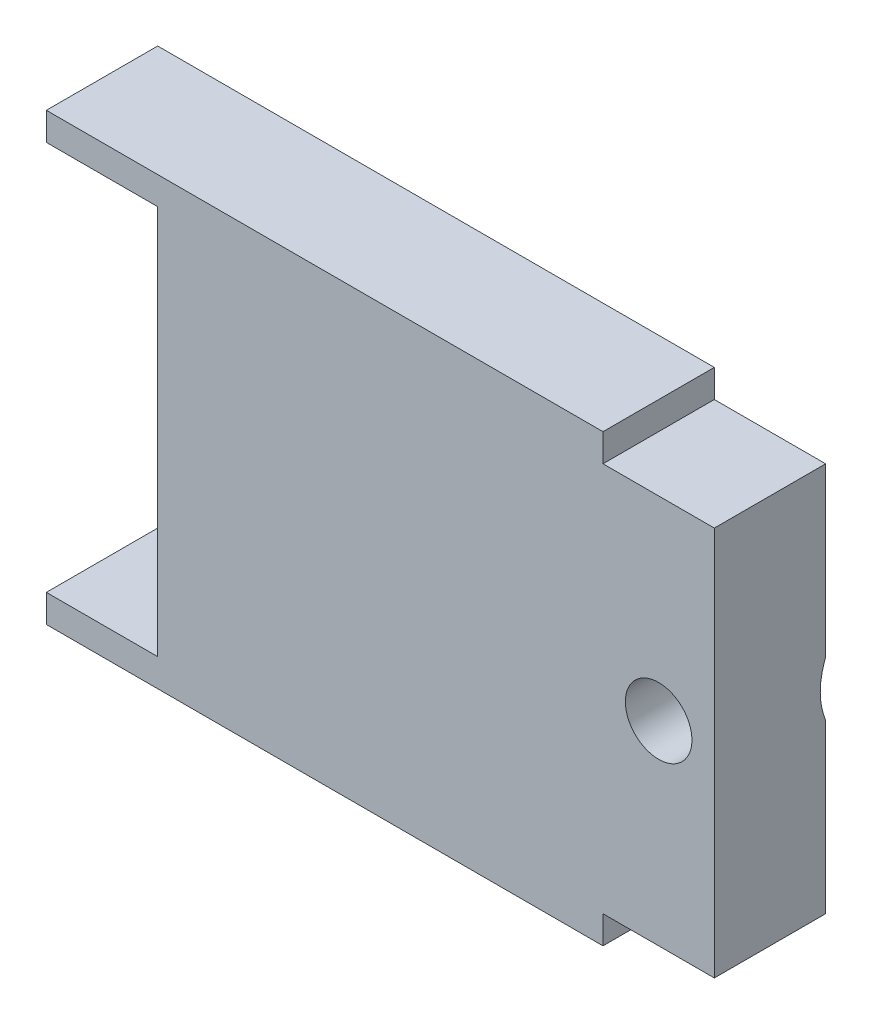
from build123d import *

# Parameters (mm, degrees)
BOSS_EXTRUDE1_DEPTH                               = 6.35
TAP_DRILL_FOR_6_32_TAP1_D                         = 2.7051
TAP_DRILL_FOR_6_32_TAP1_DEPTH                     = 12.7
TAP_DRILL_FOR_6_32_TAP1_TIP                       = 0.81269403
CSK_FOR_6_FLAT_HEAD_MACHINE_SCREW_100_D           = 3.7973
CSK_FOR_6_FLAT_HEAD_MACHINE_SCREW_100_CSINK_D     = 7.0866
CSK_FOR_6_FLAT_HEAD_MACHINE_SCREW_100_CSINK_ANGLE = 100


with BuildPart() as part:
    # Sketch1 → Boss-Extrude1 (new body)
    with BuildSketch(Plane.XY):
        Polygon((0, 23.8125), (-6.35, 23.8125), (-6.35, 25.4), (-38.1, 25.4), (-38.1, 23.8125), (-31.75, 23.8125), (-31.75, 1.5875), (-38.1, 1.5875), (-38.1, 0), (-6.35, 0), (-6.35, 1.5875), (0, 1.5875), align=None)
    extrude(amount=BOSS_EXTRUDE1_DEPTH)

    # Tap Drill for #6-32 Tap1
    with Locations(Plane.ZY.offset(31.75)):
        with Locations((3.175, 12.7)):
            Hole(TAP_DRILL_FOR_6_32_TAP1_D / 2, depth=TAP_DRILL_FOR_6_32_TAP1_DEPTH)
            with Locations((0, 0, -(TAP_DRILL_FOR_6_32_TAP1_DEPTH + TAP_DRILL_FOR_6_32_TAP1_TIP / 2))):  # 118° drill point
                Cone(0, TAP_DRILL_FOR_6_32_TAP1_D / 2, TAP_DRILL_FOR_6_32_TAP1_TIP, mode=Mode.SUBTRACT)

    # CSK for #6 Flat Head Machine Screw (100)1 (through all)
    with Locations(Plane(origin=(0, 0, 0), x_dir=(-1, 0, 0), z_dir=(0, 0, -1))):
        with Locations((3.175, 12.7)):
            CounterSinkHole(CSK_FOR_6_FLAT_HEAD_MACHINE_SCREW_100_D / 2, CSK_FOR_6_FLAT_HEAD_MACHINE_SCREW_100_CSINK_D / 2, counter_sink_angle=CSK_FOR_6_FLAT_HEAD_MACHINE_SCREW_100_CSINK_ANGLE)


solid = part.part
